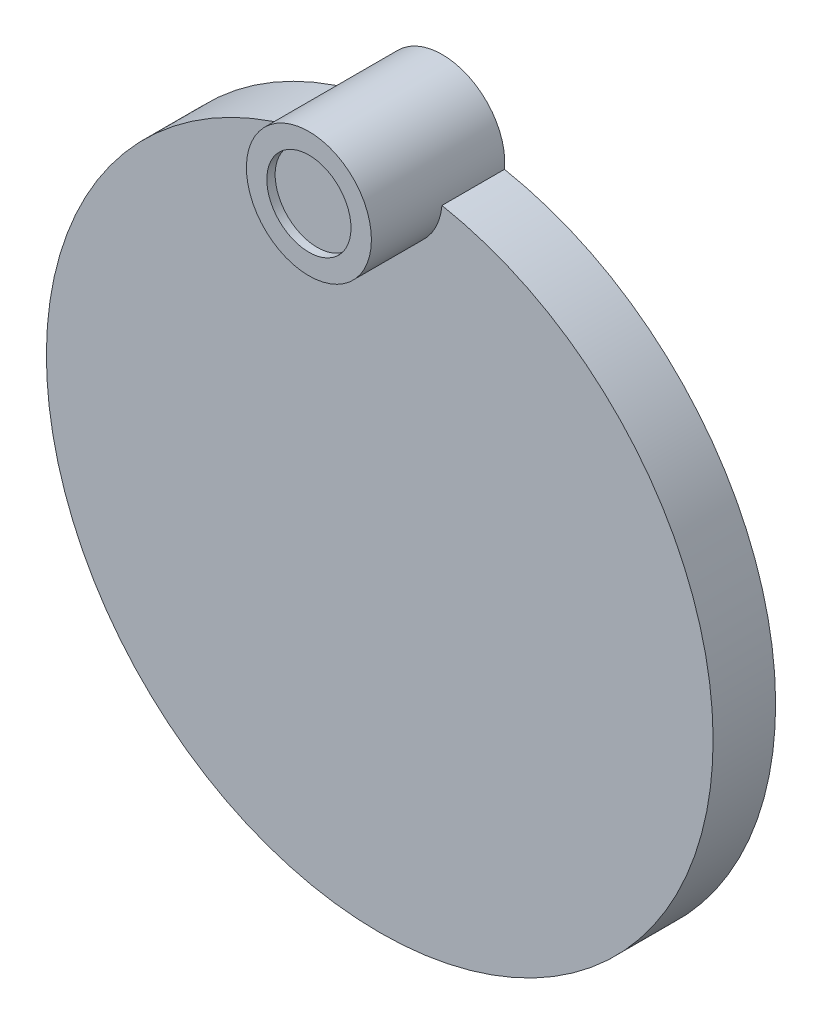
from build123d import *

# Parameters (mm, degrees)
EXTRUDE_1_DEPTH     = 15
SKETCH_5_R          = 15
EXTRUDE_3_DEPTH     = 17
SKETCH_9_R          = 10.1
CUT_EXTRUDE_2_DEPTH = 2


with BuildPart() as part:
    # ｽｹｯﾁ4 → ﾎﾞｽ - 押し出し1 (new body)
    with BuildSketch(Plane.XY):
        with BuildLine():
            ThreePointArc((14.933936552, -1.40625), (0, 15), (-14.933936552, -1.40625))
            ThreePointArc((-14.933936552, -1.40625), (0, -160), (14.933936552, -1.40625))
        make_face()
    extrude(amount=EXTRUDE_1_DEPTH)

    # ｽｹｯﾁ5 → ﾎﾞｽ - 押し出し3 (add)
    with BuildSketch(Plane.XY.offset(15)):
        with Locations(Location((0, 0, 0), (0, 0, 185.379378991))):
            Circle(SKETCH_5_R)
    extrude(amount=EXTRUDE_3_DEPTH)

    # ｽｹｯﾁ9 → ｶｯﾄ - 押し出し2 (cut)
    with BuildSketch(Plane.XY.offset(32)):
        Circle(SKETCH_9_R)
    extrude(amount=-CUT_EXTRUDE_2_DEPTH, mode=Mode.SUBTRACT)


solid = part.part
